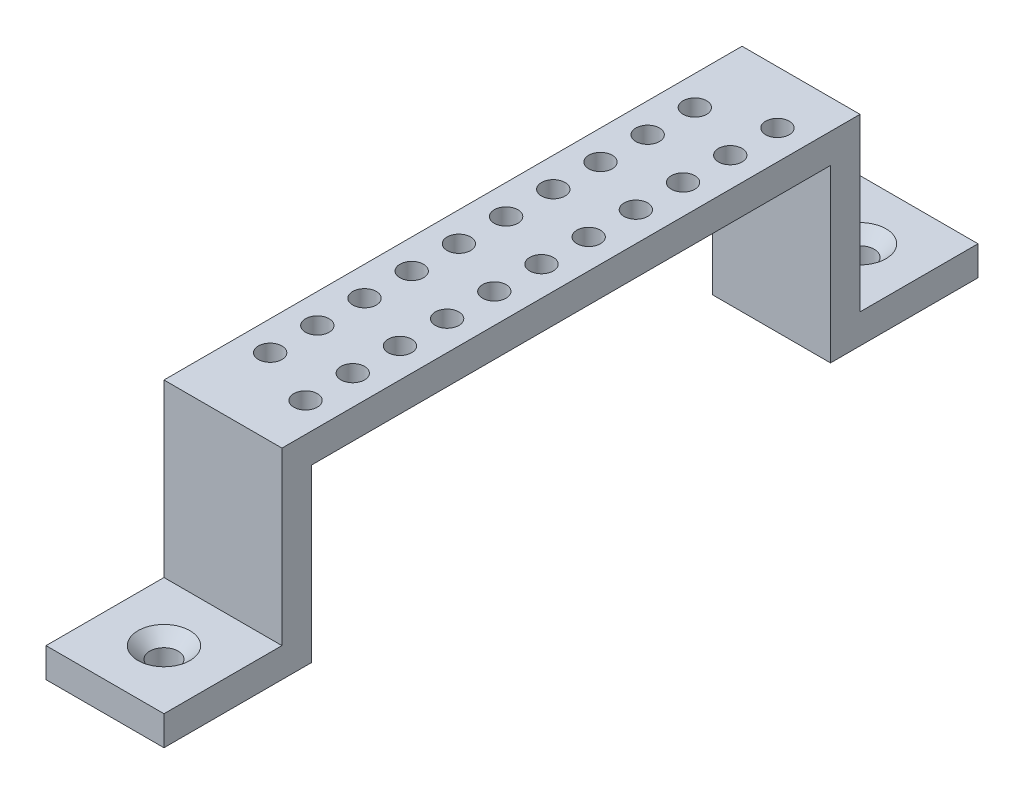
from build123d import *

# Parameters (mm, degrees)
SKETCH2_W                                       = 10
SKETCH2_H                                       = 44
BOSS_EXTRUDE3_DEPTH                             = 2.5
F_2_0MM_DOWEL_SLOT3_D                           = 2
SKETCH18_W                                      = 10
SKETCH18_H                                      = 2.5
BOSS_EXTRUDE4_DEPTH                             = 2.5
SKETCH19_W                                      = 10
SKETCH19_H                                      = 2.5
BOSS_EXTRUDE5_DEPTH                             = 2.5
SKETCH20_W                                      = 10
SKETCH20_H                                      = 2.5
BOSS_EXTRUDE6_DEPTH                             = 14.5
SKETCH22_W                                      = 10
SKETCH22_H                                      = 2.5
BOSS_EXTRUDE7_DEPTH                             = 10
SKETCH23_W                                      = 10
SKETCH23_H                                      = 2.5
BOSS_EXTRUDE8_DEPTH                             = 10
CSK_FOR_M2_FLAT_HEAD_MACHINE_SCREW1_D           = 2.4
CSK_FOR_M2_FLAT_HEAD_MACHINE_SCREW1_CSINK_D     = 4.4
CSK_FOR_M2_FLAT_HEAD_MACHINE_SCREW1_CSINK_ANGLE = 90
CSK_FOR_M2_FLAT_HEAD_MACHINE_SCREW2_D           = 2.4
CSK_FOR_M2_FLAT_HEAD_MACHINE_SCREW2_CSINK_D     = 4.4
CSK_FOR_M2_FLAT_HEAD_MACHINE_SCREW2_CSINK_ANGLE = 90


with BuildPart() as part:
    # Sketch2 → Boss-Extrude3 (new body)
    with BuildSketch(Plane(origin=(0, 0, 0), x_dir=(1, 0, 0), z_dir=(0, 1, 0))):
        with Locations((-1.558139535, -13.697674419)):
            Rectangle(SKETCH2_W, SKETCH2_H)
    extrude(amount=BOSS_EXTRUDE3_DEPTH)

    # Ø2.0mm Dowel Slot3 (through all)
    with Locations(Plane(origin=(0, 2.5, 0), x_dir=(1, 0, 0), z_dir=(0, 1, 0))):
        with Locations((-4.058139535, 4.302325581), (-4.058139535, 0.302325581), (-4.058139535, -3.697674419), (-4.058139535, -7.697674419), (-4.058139535, -11.697674419), (-4.058139535, -15.697674419), (-4.058139535, -19.697674419), (-4.058139535, -23.697674419), (-4.058139535, -27.697674419), (-4.058139535, -31.697674419), (0.941860465, 2.302325581), (0.941860465, -1.697674419), (0.941860465, -5.697674419), (0.941860465, -9.697674419), (0.941860465, -13.697674419), (0.941860465, -17.697674419), (0.941860465, -21.697674419), (0.941860465, -25.697674419), (0.941860465, -29.697674419), (0.941860465, -33.697674419), (0.941860465, 6.302325581)):
            Hole(F_2_0MM_DOWEL_SLOT3_D / 2)

    # Sketch18 → Boss-Extrude4 (add)
    with BuildSketch(Plane.XY.offset(35.697674419)):
        with Locations((-1.558139535, 1.25)):
            Rectangle(SKETCH18_W, SKETCH18_H)
    extrude(amount=BOSS_EXTRUDE4_DEPTH)

    # Sketch19 → Boss-Extrude5 (add)
    with BuildSketch(Plane(origin=(0, 0, -8.302325581), x_dir=(-1, 0, 0), z_dir=(0, 0, -1))):
        with Locations((1.558139535, 1.25)):
            Rectangle(SKETCH19_W, SKETCH19_H)
    extrude(amount=BOSS_EXTRUDE5_DEPTH)

    # Sketch20 → Boss-Extrude6 (add)
    with BuildSketch(Plane.XZ):
        with Locations((-1.558139535, 36.947674419)):
            Rectangle(SKETCH20_W, SKETCH20_H)
        with Locations((-1.558139535, -9.552325581)):
            Rectangle(SKETCH20_W, SKETCH20_H)
    extrude(amount=BOSS_EXTRUDE6_DEPTH)

    # Sketch22 → Boss-Extrude7 (add)
    with BuildSketch(Plane(origin=(0, 0, -10.802325581), x_dir=(-1, 0, 0), z_dir=(0, 0, -1))):
        with Locations((1.558139535, -13.25)):
            Rectangle(SKETCH22_W, SKETCH22_H)
    extrude(amount=BOSS_EXTRUDE7_DEPTH)

    # Sketch23 → Boss-Extrude8 (add)
    with BuildSketch(Plane.XY.offset(38.197674419)):
        with Locations((-1.558139535, -13.25)):
            Rectangle(SKETCH23_W, SKETCH23_H)
    extrude(amount=BOSS_EXTRUDE8_DEPTH)

    # CSK for M2 Flat Head Machine Screw1 (through all)
    with Locations(Plane(origin=(0, -12, 0), x_dir=(1, 0, 0), z_dir=(0, 1, 0))):
        with Locations((-1.558139535, 15.802325581)):
            CounterSinkHole(CSK_FOR_M2_FLAT_HEAD_MACHINE_SCREW1_D / 2, CSK_FOR_M2_FLAT_HEAD_MACHINE_SCREW1_CSINK_D / 2, counter_sink_angle=CSK_FOR_M2_FLAT_HEAD_MACHINE_SCREW1_CSINK_ANGLE)

    # CSK for M2 Flat Head Machine Screw2 (through all)
    with Locations(Plane(origin=(0, -12, 0), x_dir=(1, 0, 0), z_dir=(0, 1, 0))):
        with Locations((-1.558139535, -43.197674419)):
            CounterSinkHole(CSK_FOR_M2_FLAT_HEAD_MACHINE_SCREW2_D / 2, CSK_FOR_M2_FLAT_HEAD_MACHINE_SCREW2_CSINK_D / 2, counter_sink_angle=CSK_FOR_M2_FLAT_HEAD_MACHINE_SCREW2_CSINK_ANGLE)


solid = part.part
